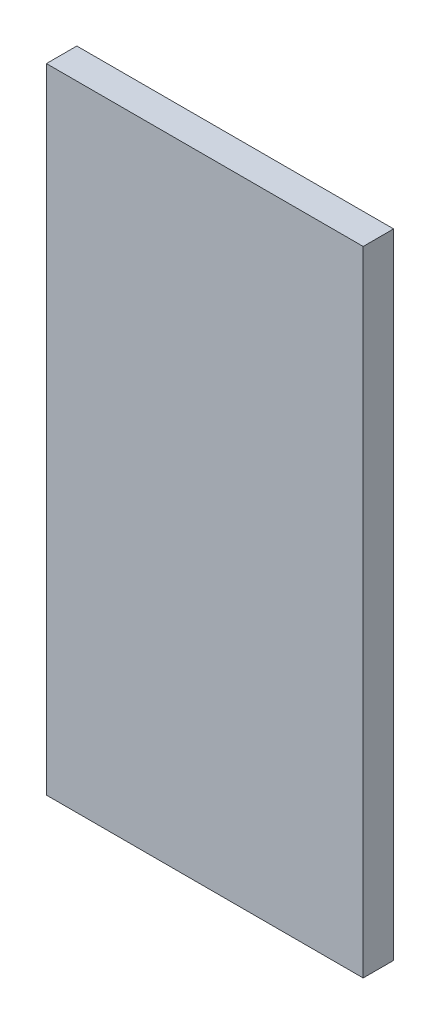
from build123d import *

# Parameters (mm, degrees)
SKETCH1_W           = 50
SKETCH1_H           = 100
BOSS_EXTRUDE1_DEPTH = 4.8


with BuildPart() as part:
    # Sketch1 → Boss-Extrude1 (new body)
    with BuildSketch(Plane.XY):
        Rectangle(SKETCH1_W, SKETCH1_H)
    extrude(amount=BOSS_EXTRUDE1_DEPTH)


solid = part.part
